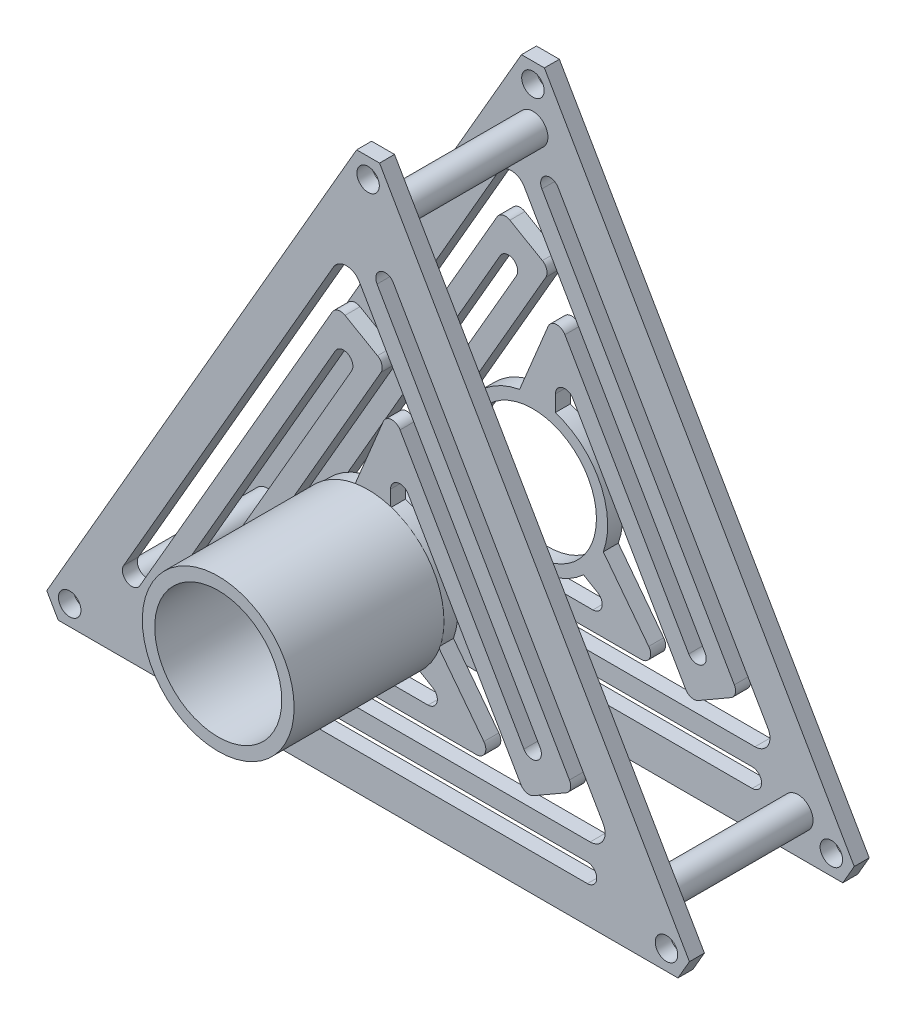
from build123d import *

# Parameters (mm, degrees)
SKETCH2_R           = 1.499999048
SKETCH2_R_2         = 8.476232568
BOSS_EXTRUDE1_DEPTH = 2
SKETCH3_R           = 2.000000571
BOSS_EXTRUDE4_DEPTH = 20
SKETCH5_R           = 1.499999048
SKETCH5_R_2         = 8.476232568
BOSS_EXTRUDE5_DEPTH = 2
SKETCH6_R           = 10.130319586
SKETCH6_R_2         = 8.476232568
BOSS_EXTRUDE6_DEPTH = 20


with BuildPart() as part:
    # Sketch2 → Boss-Extrude1 (new body)
    with BuildSketch(Plane.XY):
        Polygon((-1.529977411, 48.635467476), (1.529978834, 48.635467476), (42.884606582, -22.992698001), (41.354559362, -25.642734021), (-41.354559362, -25.642734021), (-42.884539813, -22.992735729), align=None)
        with Locations((-39.824585131, -22.992733702)):
            Circle(SKETCH2_R, mode=Mode.SUBTRACT)
        Circle(SKETCH2_R_2, mode=Mode.SUBTRACT)
        with Locations((1.077e-06, 45.98546927)):
            Circle(SKETCH2_R, mode=Mode.SUBTRACT)
        with Locations((39.824584054, -22.992735568)):
            Circle(SKETCH2_R, mode=Mode.SUBTRACT)
        with BuildLine():
            Line((8.625743911, -8.444177918), (6.753395324, -7.344905536))
            ThreePointArc((6.753395324, -7.344905536), (-0.619839897, -9.958503112), (-7.612069336, -6.450766323))
            Line((-7.612069336, -6.450766323), (-17.483000044, -7.749839951))
            ThreePointArc((-17.483000044, -7.749839951), (-18.685453818, -7.204965543), (-18.728632678, -5.885526729))
            Line((-18.728632678, -5.885526729), (-2.199572243, 22.743645745))
            ThreePointArc((-2.199572243, 22.743645745), (-2.657104073, 24.45117778), (-4.364636107, 23.99364595))
            Line((-4.364636107, 23.99364595), (-28.480761019, -17.776707679))
            ThreePointArc((-28.480761019, -17.776707679), (-28.480761019, -19.776707679), (-26.748710212, -20.776707679))
            Line((-26.748710212, -20.776707679), (29.264627025, -20.776707679))
            ThreePointArc((29.264627025, -20.776707679), (30.514626764, -19.52670794), (29.264627025, -18.276708201))
            Line((29.264627025, -18.276708201), (-22.096788511, -18.276708201))
            ThreePointArc((-22.096788511, -18.276708201), (-22.980671746, -17.910592355), (-23.34678825, -17.026709393))
            Line((-23.34678825, -17.026709393), (-23.34678825, -12.026708573))
            ThreePointArc((-23.34678825, -12.026708573), (-22.980671803, -11.142825281), (-22.096788511, -10.776708834))
            Line((-22.096788511, -10.776708834), (8.000743575, -10.776708834))
            ThreePointArc((8.000743575, -10.776708834), (9.201417559, -9.848429046), (8.625743911, -8.444177918))
        make_face(mode=Mode.SUBTRACT)
        with BuildLine():
            Line((-18.596788868, -15.776708722), (29.635460955, -15.776708722))
            ThreePointArc((29.635460955, -15.776708722), (31.367511763, -14.776708722), (31.367511763, -12.776708722))
            Line((31.367511763, -12.776708722), (3.360843145, 35.732264275))
            ThreePointArc((3.360843145, 35.732264275), (1.653311746, 36.189795934), (1.195780087, 34.482264536))
            Line((1.195780087, 34.482264536), (26.876487855, -9.998026092))
            ThreePointArc((26.876487855, -9.998026092), (27.00136385, -10.946549351), (26.418957002, -11.705557025))
            Line((26.418957002, -11.705557025), (22.088829273, -14.205557435))
            ThreePointArc((22.088829273, -14.205557435), (21.140305665, -14.330432937), (20.381297875, -13.748025775))
            Line((20.381297875, -13.748025775), (5.332531832, 12.317201602))
            ThreePointArc((5.332531832, 12.317201602), (3.928280962, 12.89287588), (3.000000636, 11.692202312))
            Line((3.000000636, 11.692202312), (2.984177121, 9.52106468))
            ThreePointArc((2.984177121, 9.52106468), (8.934236627, 4.442454459), (9.392562178, -3.366862259))
            Line((9.392562178, -3.366862259), (15.453058295, -11.265802197))
            ThreePointArc((15.453058295, -11.265802197), (15.582410103, -12.579594916), (14.461332001, -13.276708312))
            Line((14.461332001, -13.276708312), (-18.596788868, -13.276708312))
            ThreePointArc((-18.596788868, -13.276708312), (-19.846789073, -14.526708517), (-18.596788868, -15.776708722))
        make_face(mode=Mode.SUBTRACT)
        with BuildLine():
            Line((-32.625470169, -14.955556596), (-4.618801551, 33.553416401))
            ThreePointArc((-4.618801551, 33.553416401), (-2.886750744, 34.553416401), (-1.154699936, 33.553416401))
            Line((-1.154699936, 33.553416401), (22.961424976, -8.216937228))
            ThreePointArc((22.961424976, -8.216937228), (22.503893146, -9.924469262), (20.796361111, -9.466937433))
            Line((20.796361111, -9.466937433), (4.267300677, 19.162235041))
            ThreePointArc((4.267300677, 19.162235041), (3.103043715, 19.78456046), (2.029941749, 19.015642148))
            Line((2.029941749, 19.015642148), (-1.780492842, 9.817628582))
            ThreePointArc((-1.780492842, 9.817628582), (-8.31439673, 5.516048653), (-9.737572444, -2.176159144))
            Line((-9.737572444, -2.176159144), (-11.625744547, -3.248024394))
            ThreePointArc((-11.625744547, -3.248024394), (-13.12969852, -3.044446834), (-13.333275407, -1.540492769))
            Line((-13.333275407, -1.540492769), (1.715490636, 24.524734609))
            ThreePointArc((1.715490636, 24.524734609), (1.840366138, 25.473258218), (1.257958977, 26.232266008))
            Line((1.257958977, 26.232266008), (-3.072168752, 28.732266418))
            ThreePointArc((-3.072168752, 28.732266418), (-4.020692104, 28.857141706), (-4.779699344, 28.274734293))
            Line((-4.779699344, 28.274734293), (-30.460407112, -16.205556335))
            ThreePointArc((-30.460407112, -16.205556335), (-32.16793851, -16.663087995), (-32.625470169, -14.955556596))
        make_face(mode=Mode.SUBTRACT)
    extrude(amount=BOSS_EXTRUDE1_DEPTH)

    # Sketch3 → Boss-Extrude4 (add)
    with BuildSketch(Plane.XY.offset(2)):
        with Locations((-35.383429378, -20.428633317)):
            Circle(SKETCH3_R)
        with Locations((35.383430107, -20.428632056)):
            Circle(SKETCH3_R)
        with Locations((-7.28e-07, 40.857265373)):
            Circle(SKETCH3_R)
    extrude(amount=BOSS_EXTRUDE4_DEPTH)

    # Sketch5 → Boss-Extrude5 (add)
    with BuildSketch(Plane.XY.offset(22)):
        Polygon((-1.529977411, 48.635467476), (1.529978834, 48.635467476), (42.884606582, -22.992698001), (41.354559362, -25.642734021), (-41.354559362, -25.642734021), (-42.884539813, -22.992735729), align=None)
        with Locations(Location((-39.824585103, -22.992733751, 0), (0, 0, 1.842e-06))):
            Circle(SKETCH5_R, mode=Mode.SUBTRACT)
        Circle(SKETCH5_R_2, mode=Mode.SUBTRACT)
        with Locations((1.021e-06, 45.98546927)):
            Circle(SKETCH5_R, mode=Mode.SUBTRACT)
        with Locations(Location((39.824584082, -22.992735519, 0), (0, 0, 359.999998157))):
            Circle(SKETCH5_R, mode=Mode.SUBTRACT)
        with BuildLine():
            Line((8.625743911, -8.444177918), (6.753395324, -7.344905536))
            ThreePointArc((6.753395324, -7.344905536), (-0.619839897, -9.958503112), (-7.612069336, -6.450766323))
            Line((-7.612069336, -6.450766323), (-17.483000044, -7.749839951))
            ThreePointArc((-17.483000044, -7.749839951), (-18.685453818, -7.204965543), (-18.728632678, -5.885526729))
            Line((-18.728632678, -5.885526729), (-2.199572243, 22.743645745))
            ThreePointArc((-2.199572243, 22.743645745), (-2.657104073, 24.45117778), (-4.364636107, 23.99364595))
            Line((-4.364636107, 23.99364595), (-28.480761019, -17.776707679))
            ThreePointArc((-28.480761019, -17.776707679), (-28.480761019, -19.776707679), (-26.748710212, -20.776707679))
            Line((-26.748710212, -20.776707679), (29.264627025, -20.776707679))
            ThreePointArc((29.264627025, -20.776707679), (30.514626764, -19.52670794), (29.264627025, -18.276708201))
            Line((29.264627025, -18.276708201), (-22.096790373, -18.276708201))
            ThreePointArc((-22.096790373, -18.276708201), (-22.980673007, -17.910592026), (-23.346789181, -17.026709393))
            Line((-23.346789181, -17.026709393), (-23.346789181, -12.026708573))
            ThreePointArc((-23.346789181, -12.026708573), (-22.980672734, -11.142825281), (-22.096789442, -10.776708834))
            Line((-22.096789442, -10.776708834), (8.000743575, -10.776708834))
            ThreePointArc((8.000743575, -10.776708834), (9.201417559, -9.848429046), (8.625743911, -8.444177918))
        make_face(mode=Mode.SUBTRACT)
        with BuildLine():
            Line((-18.596788868, -15.776708722), (29.635460955, -15.776708722))
            ThreePointArc((29.635460955, -15.776708722), (31.367511763, -14.776708722), (31.367511763, -12.776708722))
            Line((31.367511763, -12.776708722), (3.360843145, 35.732264275))
            ThreePointArc((3.360843145, 35.732264275), (1.653311746, 36.189795934), (1.195780087, 34.482264536))
            Line((1.195780087, 34.482264536), (26.876488786, -9.998027705))
            ThreePointArc((26.876488786, -9.998027705), (27.001364195, -10.946550607), (26.418957468, -11.705557831))
            Line((26.418957468, -11.705557831), (22.088829739, -14.205558241))
            ThreePointArc((22.088829739, -14.205558241), (21.14030613, -14.330433743), (20.38129834, -13.748026582))
            Line((20.38129834, -13.748026582), (5.332531832, 12.317201602))
            ThreePointArc((5.332531832, 12.317201602), (3.928280962, 12.89287588), (3.000000636, 11.692202312))
            Line((3.000000636, 11.692202312), (2.984177121, 9.52106468))
            ThreePointArc((2.984177121, 9.52106468), (8.934236627, 4.442454459), (9.392562178, -3.366862259))
            Line((9.392562178, -3.366862259), (15.453058295, -11.265802197))
            ThreePointArc((15.453058295, -11.265802197), (15.582410103, -12.579594916), (14.461332001, -13.276708312))
            Line((14.461332001, -13.276708312), (-18.596788868, -13.276708312))
            ThreePointArc((-18.596788868, -13.276708312), (-19.846789073, -14.526708517), (-18.596788868, -15.776708722))
        make_face(mode=Mode.SUBTRACT)
        with BuildLine():
            Line((-32.625470169, -14.955556596), (-4.618801551, 33.553416401))
            ThreePointArc((-4.618801551, 33.553416401), (-2.886750744, 34.553416401), (-1.154699936, 33.553416401))
            Line((-1.154699936, 33.553416401), (22.961424976, -8.216937228))
            ThreePointArc((22.961424976, -8.216937228), (22.503893146, -9.924469262), (20.796361111, -9.466937433))
            Line((20.796361111, -9.466937433), (4.267300677, 19.162235041))
            ThreePointArc((4.267300677, 19.162235041), (3.103043715, 19.78456046), (2.029941749, 19.015642148))
            Line((2.029941749, 19.015642148), (-1.780492842, 9.817628582))
            ThreePointArc((-1.780492842, 9.817628582), (-8.31439673, 5.516048653), (-9.737572444, -2.176159144))
            Line((-9.737572444, -2.176159144), (-11.625744547, -3.248024394))
            ThreePointArc((-11.625744547, -3.248024394), (-13.12969852, -3.044446834), (-13.333275407, -1.540492769))
            Line((-13.333275407, -1.540492769), (1.715491102, 24.524735416))
            ThreePointArc((1.715491102, 24.524735416), (1.840366604, 25.473259024), (1.257959442, 26.232266814))
            Line((1.257959442, 26.232266814), (-3.072168286, 28.732267224))
            ThreePointArc((-3.072168286, 28.732267224), (-4.020691188, 28.857142633), (-4.779698413, 28.274735906))
            Line((-4.779698413, 28.274735906), (-30.460407112, -16.205556335))
            ThreePointArc((-30.460407112, -16.205556335), (-32.16793851, -16.663087995), (-32.625470169, -14.955556596))
        make_face(mode=Mode.SUBTRACT)
    extrude(amount=BOSS_EXTRUDE5_DEPTH)

    # Sketch6 → Boss-Extrude6 (add)
    with BuildSketch(Plane.XY.offset(24)):
        with Locations(Location((0, 0, 0), (0, 0, 192.86084428))):
            Circle(SKETCH6_R)
        Circle(SKETCH6_R_2, mode=Mode.SUBTRACT)
    extrude(amount=BOSS_EXTRUDE6_DEPTH)


solid = part.part
